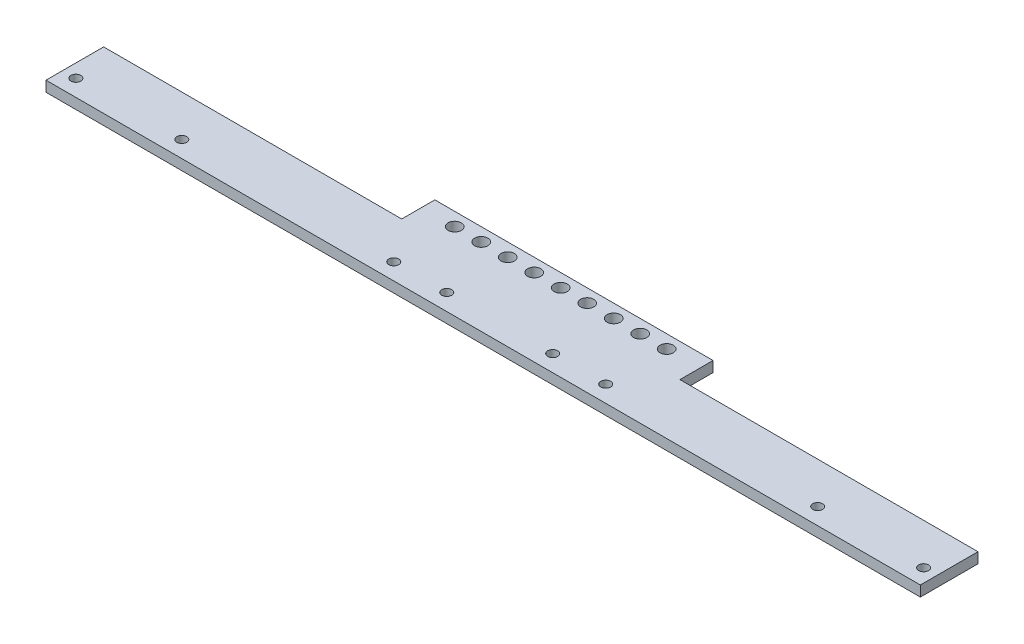
from build123d import *

# Parameters (mm, degrees)
SKETCH1_R           = 2
SKETCH1_R_2         = 1.5
BOSS_EXTRUDE1_DEPTH = 3.175
SKETCH2_R           = 1.5
CUT_EXTRUDE1_DEPTH  = 10
SKETCH3_W           = 90
SKETCH3_H           = 10
CUT_EXTRUDE2_DEPTH  = 10
CUT_EXTRUDE3_START  = -10
SKETCH4_R           = 2
CUT_EXTRUDE3_DEPTH  = 10


with BuildPart() as part:
    # Sketch1 → Boss-Extrude1 (new body)
    with BuildSketch(Plane(origin=(0, 0, 0), x_dir=(1, 0, 0), z_dir=(0, 1, 0))):
        Polygon((0, 25.535634143), (0, -1.869964777), (264, -1.869964777), (264, 3.130035223), (264, 25.535634143), align=None)
        with Locations((132, 21.535634143)):
            Circle(SKETCH1_R, mode=Mode.SUBTRACT)
        with Locations((100, 21.535634143)):
            Circle(SKETCH1_R, mode=Mode.SUBTRACT)
        with Locations((68, 21.535634143)):
            Circle(SKETCH1_R, mode=Mode.SUBTRACT)
        with Locations((196, 21.535634143)):
            Circle(SKETCH1_R, mode=Mode.SUBTRACT)
        with Locations((164, 21.535634143)):
            Circle(SKETCH1_R, mode=Mode.SUBTRACT)
        with Locations((260, 3.130035223)):
            Circle(SKETCH1_R_2, mode=Mode.SUBTRACT)
        with Locations((36, 3.130035223)):
            Circle(SKETCH1_R_2, mode=Mode.SUBTRACT)
        with Locations((228, 3.130035223)):
            Circle(SKETCH1_R_2, mode=Mode.SUBTRACT)
        with Locations((4, 3.130035223)):
            Circle(SKETCH1_R_2, mode=Mode.SUBTRACT)
    extrude(amount=BOSS_EXTRUDE1_DEPTH)

    # Sketch2 → Cut-Extrude1 (cut)
    with BuildSketch(Plane(origin=(0, 3.175, 0), x_dir=(1, 0, 0), z_dir=(0, 1, 0))):
        with Locations((116, 3.130035223)):
            Circle(SKETCH2_R)
        with Locations((148, 3.130035223)):
            Circle(SKETCH2_R)
        with Locations((100, 3.130035223)):
            Circle(SKETCH2_R)
        with Locations((164, 3.130035223)):
            Circle(SKETCH2_R)
    extrude(amount=-CUT_EXTRUDE1_DEPTH, mode=Mode.SUBTRACT)

    # Sketch3 → Cut-Extrude2 (cut)
    with BuildSketch(Plane(origin=(0, 3.175, 0), x_dir=(1, 0, 0), z_dir=(0, 1, 0))):
        with Locations((45, 20.535634143)):
            Rectangle(SKETCH3_W, SKETCH3_H)
        with Locations((219, 20.535634143)):
            Rectangle(SKETCH3_W, SKETCH3_H)
    extrude(amount=-CUT_EXTRUDE2_DEPTH, mode=Mode.SUBTRACT)

    # Sketch4 → Cut-Extrude3 (cut)
    with BuildSketch(Plane(origin=(0, 3.175, 0), x_dir=(1, 0, 0), z_dir=(0, 1, 0)).offset(CUT_EXTRUDE3_START)):
        with Locations((100, 21.535634143)):
            Circle(SKETCH4_R)
        with Locations((108, 21.535634143)):
            Circle(SKETCH4_R)
        with Locations((116, 21.535634143)):
            Circle(SKETCH4_R)
        with Locations((124, 21.535634143)):
            Circle(SKETCH4_R)
        with Locations((132, 21.535634143)):
            Circle(SKETCH4_R)
        with Locations((140, 21.535634143)):
            Circle(SKETCH4_R)
        with Locations((148, 21.535634143)):
            Circle(SKETCH4_R)
        with Locations((156, 21.535634143)):
            Circle(SKETCH4_R)
        with Locations((164, 21.535634143)):
            Circle(SKETCH4_R)
    extrude(amount=CUT_EXTRUDE3_DEPTH, mode=Mode.SUBTRACT)


solid = part.part
